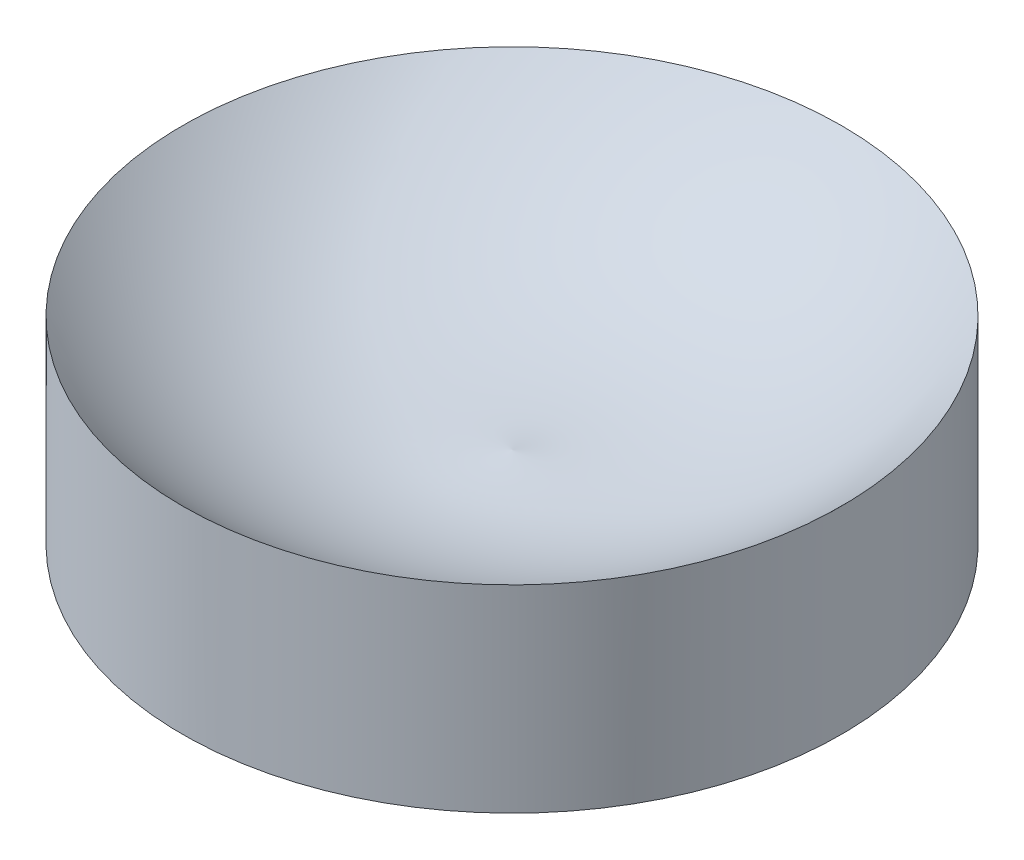
from build123d import *


with BuildPart() as part:
    # Sketch1 → Revolve1 (revolve)
    with BuildSketch(Plane(origin=(0, 0, 0), x_dir=(0, 0, -1), z_dir=(1, 0, 0)), mode=Mode.PRIVATE) as revolve1_sk:
        with BuildLine():
            Line((0, 0), (-5, 0))
            Line((-5, 0), (-5, 3))
            add(Edge.make_bspline(
                [(-5, 3), (-2.907653993, 0.884550938), (0, 1.237872987)],
                knots=[0, 0, 0, 1, 1, 1], degree=2))
            Line((0, 1.237872987), (0, 0))
        make_face()
    revolve(revolve1_sk.sketch.rotate(Axis((0, 0, 0), (0, 1, 0)), 180), axis=Axis((0, 0, 0), (0, 1, 0)))


solid = part.part
